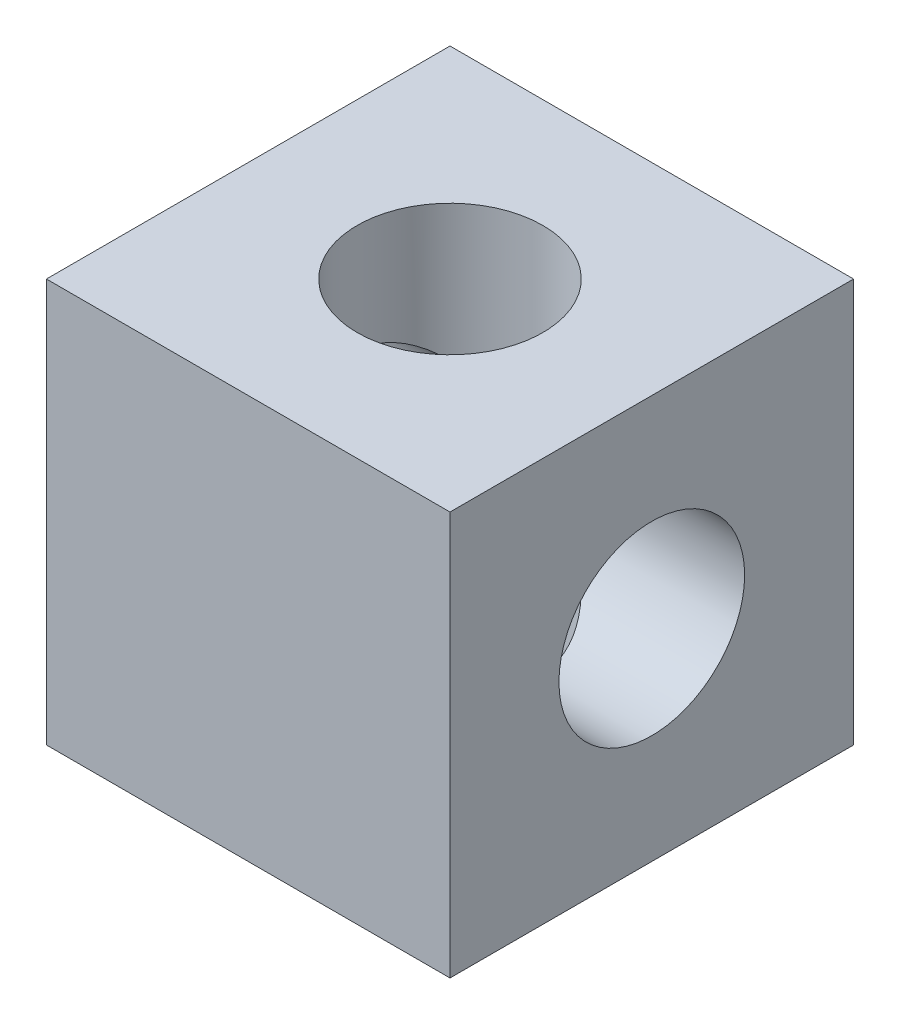
from build123d import *

# Parameters (mm, degrees)
IZIM1_W                     = 20.32
IZIM1_H                     = 20.32
Y_KSEKLIK_EKSTR_ZYON1_DEPTH = 20.32
IZIM2_R                     = 4.675
KES_EKSTR_ZYON1_DEPTH       = 32.417644606
IZIM3_R                     = 4.675
KES_EKSTR_ZYON2_DEPTH       = 32.790468526


with BuildPart() as part:
    # Çizim1 → Yükseklik-Ekstrüzyon1 (new body)
    with BuildSketch(Plane.XY):
        with Locations((-2.538960295, -3.435186246)):
            Rectangle(IZIM1_W, IZIM1_H)
    extrude(amount=Y_KSEKLIK_EKSTR_ZYON1_DEPTH)

    # Çizim2 → Kes-Ekstrüzyon1 (cut, through all)
    with BuildSketch(Plane(origin=(0, 6.724813754, 0), x_dir=(1, 0, 0), z_dir=(0, 1, 0))):
        with Locations(Location((-2.538960295, -10.16, 0), (0, 0, 270))):
            Circle(IZIM2_R)
    extrude(amount=-KES_EKSTR_ZYON1_DEPTH, mode=Mode.SUBTRACT)

    # Çizim3 → Kes-Ekstrüzyon2 (cut, through all)
    with BuildSketch(Plane.ZY.offset(12.698960295)):
        with Locations((10.16, -3.435186246)):
            Circle(IZIM3_R)
    extrude(amount=-KES_EKSTR_ZYON2_DEPTH, mode=Mode.SUBTRACT)


solid = part.part
